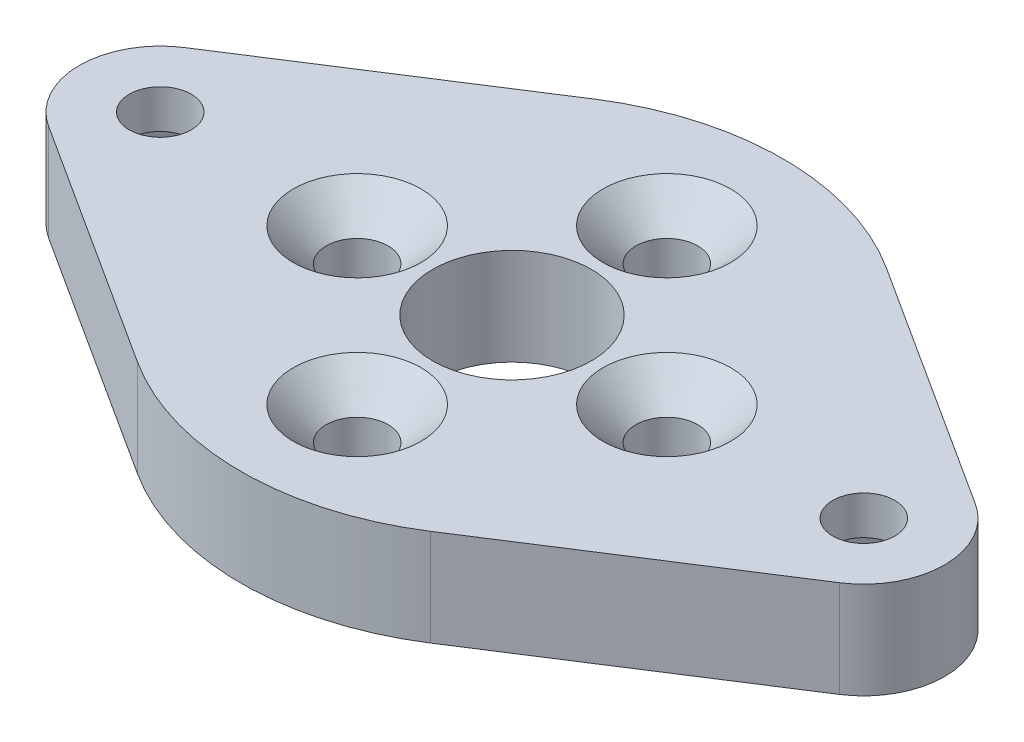
from build123d import *

# Parameters (mm, degrees)
SKETCH1_R           = 4.1
SKETCH1_R_2         = 1.6
BOSS_EXTRUDE1_DEPTH = 5
CHAMFER1_SIZE       = 1.7
CUT_EXTRUDE1_DEPTH  = 3


with BuildPart() as part:
    # Sketch1 → Boss-Extrude1 (new body)
    with BuildSketch(Plane(origin=(0, 0, 0), x_dir=(1, 0, 0), z_dir=(0, 1, 0))):
        with BuildLine():
            Line((-20.432418055, 3.512858569), (-7.567581945, 11.778442321))
            ThreePointArc((-7.567581945, 11.778442321), (0, 14), (7.567581945, 11.778442321))
            Line((7.567581945, 11.778442321), (20.432418055, 3.512858569))
            ThreePointArc((20.432418055, 3.512858569), (22.350852961, 0), (20.432418055, -3.512858569))
            Line((20.432418055, -3.512858569), (7.567581945, -11.778442321))
            ThreePointArc((7.567581945, -11.778442321), (0, -14), (-7.567581945, -11.778442321))
            Line((-7.567581945, -11.778442321), (-20.432418055, -3.512858569))
            ThreePointArc((-20.432418055, -3.512858569), (-22.350852961, 0), (-20.432418055, 3.512858569))
        make_face()
        with Locations(Location((0, 0, 0), (0, 0, 270))):
            Circle(SKETCH1_R, mode=Mode.SUBTRACT)
        with Locations(Location((-18.175426481, 0, 0), (0, 0, 270))):
            Circle(SKETCH1_R_2, mode=Mode.SUBTRACT)
        with Locations(Location((18.175426481, 0, 0), (0, 0, 270))):
            Circle(SKETCH1_R_2, mode=Mode.SUBTRACT)
        with Locations(Location((0, 8, 0), (0, 0, 270))):
            Circle(SKETCH1_R_2, mode=Mode.SUBTRACT)
        with Locations(Location((8, 0, 0), (0, 0, 270))):
            Circle(SKETCH1_R_2, mode=Mode.SUBTRACT)
        with Locations(Location((0, -8, 0), (0, 0, 270))):
            Circle(SKETCH1_R_2, mode=Mode.SUBTRACT)
        with Locations(Location((-8, 0, 0), (0, 0, 270))):
            Circle(SKETCH1_R_2, mode=Mode.SUBTRACT)
    extrude(amount=BOSS_EXTRUDE1_DEPTH)

    # Chamfer1
    chamfer1_edges = [part.edges().sort_by_distance(p)[0] for p in [
        (0, 5, -9.6),
        (8, 5, -1.6),
        (0, 5, 6.4),
        (-8, 5, -1.6),
    ]]
    chamfer(chamfer1_edges, length=CHAMFER1_SIZE)

    # Sketch2 → Cut-Extrude1 (cut)
    with BuildSketch(Plane.XZ):
        Polygon((-15, 0), (-16.58771324, 2.75), (-19.763139721, 2.75), (-21.350852961, 0), (-19.763139721, -2.75), (-16.58771324, -2.75), align=None)
        Polygon((15, 0), (16.58771324, -2.75), (19.763139721, -2.75), (21.350852961, 0), (19.763139721, 2.75), (16.58771324, 2.75), align=None)
    extrude(amount=-CUT_EXTRUDE1_DEPTH, mode=Mode.SUBTRACT)


solid = part.part
